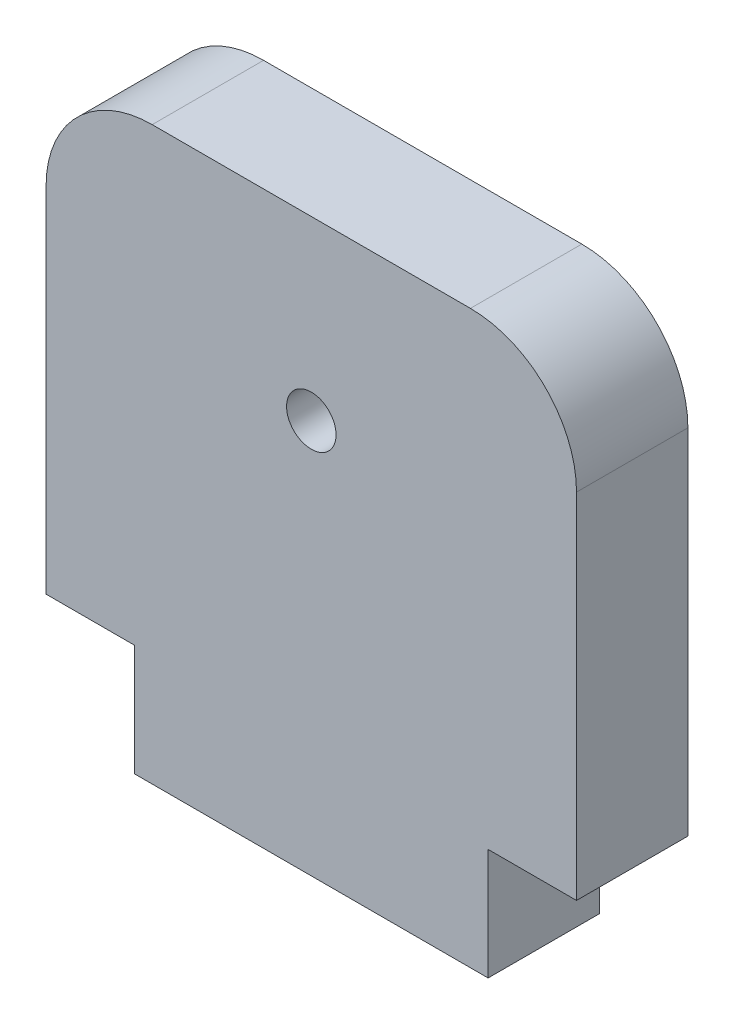
from build123d import *

# Parameters (mm, degrees)
SKETCH2_R           = 0.889
BOSS_EXTRUDE1_DEPTH = 4


with BuildPart() as part:
    # Sketch2 → Boss-Extrude1 (new body)
    with BuildSketch(Plane.XY):
        with BuildLine():
            Line((-9.525, -8.255), (-6.35, -8.255))
            Line((-6.35, -8.255), (-6.35, -12.255))
            Line((-6.35, -12.255), (6.35, -12.255))
            Line((6.35, -12.255), (6.35, -8.255))
            Line((6.35, -8.255), (9.525, -8.255))
            Line((9.525, -8.255), (9.525, 4.445))
            ThreePointArc((9.525, 4.445), (8.409076836, 7.139076836), (5.715, 8.255))
            Line((5.715, 8.255), (-5.715, 8.255))
            ThreePointArc((-5.715, 8.255), (-8.409076836, 7.139076836), (-9.525, 4.445))
            Line((-9.525, 4.445), (-9.525, -8.255))
        make_face()
        with Locations((0, 1.905)):
            Circle(SKETCH2_R, mode=Mode.SUBTRACT)
    extrude(amount=BOSS_EXTRUDE1_DEPTH)


solid = part.part
